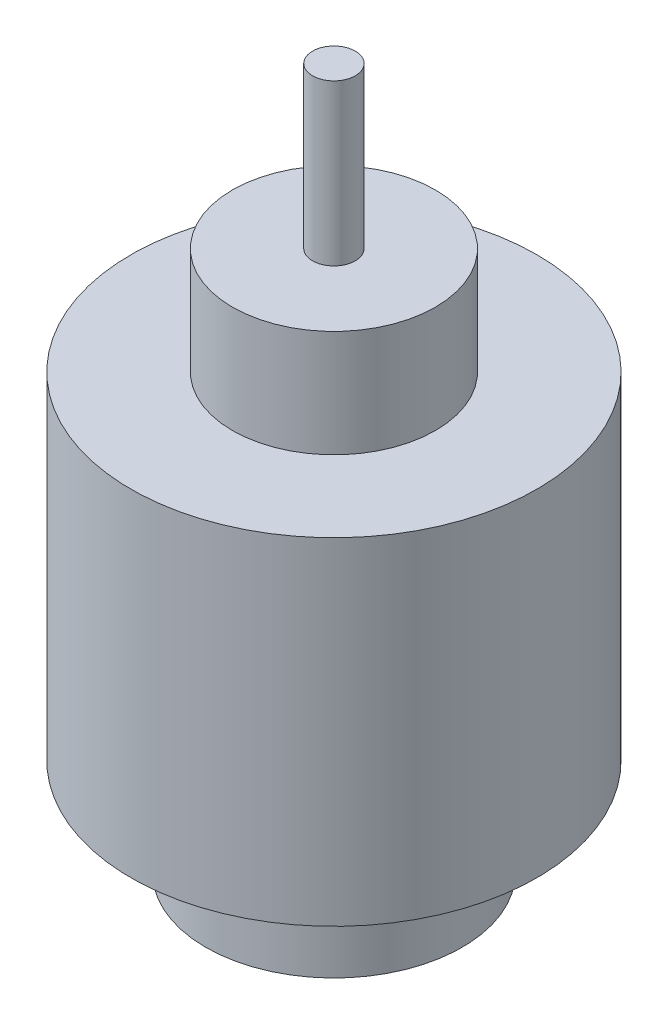
from build123d import *


with BuildPart() as part:
    # Sketch2 → Revolve1 (revolve)
    with BuildSketch(Plane.XY, mode=Mode.PRIVATE) as revolve1_sk:
        Polygon((0, 0), (0, 70), (2, 70), (2, 55), (9.5, 55), (9.5, 45), (19, 45), (19, 13.507164615), (12, 13.507164615), (12, 4.370634376), (3.484092997, 4.370634376), (3.484092997, 0), align=None)
    revolve(revolve1_sk.sketch.rotate(Axis((0, 0, 0), (0, 1, 0)), 90), axis=Axis((0, 0, 0), (0, 1, 0)))


solid = part.part
